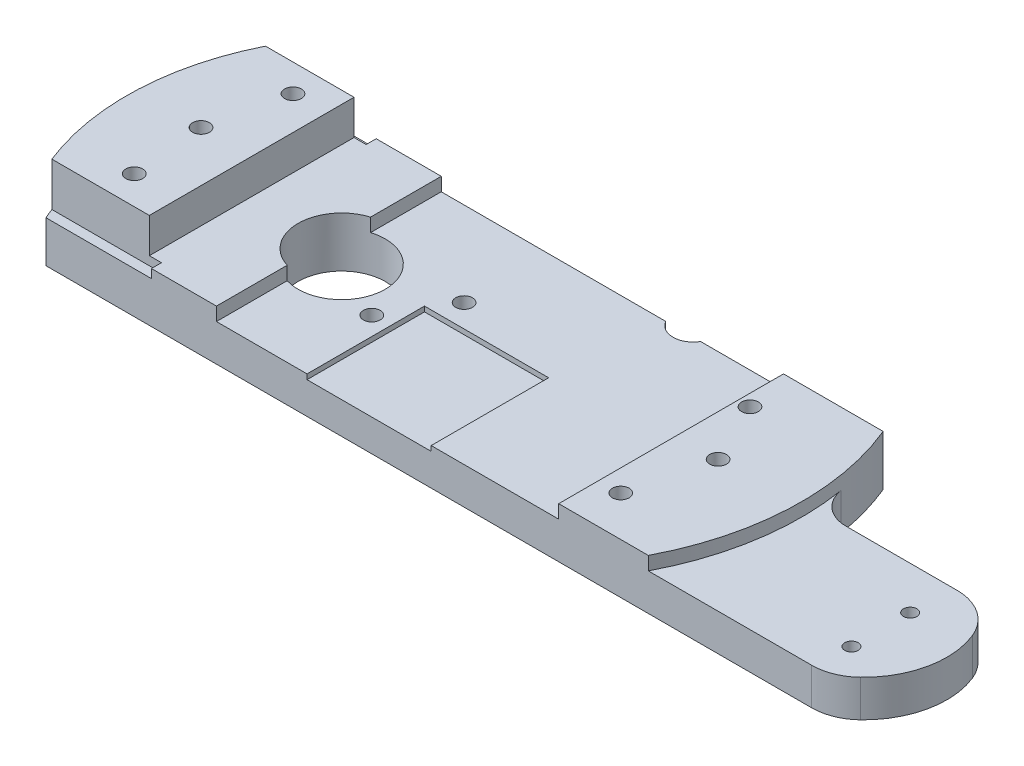
from build123d import *

# Parameters (mm, degrees)
SKETCH1_W           = 195
SKETCH1_H           = 67
BOSS_EXTRUDE1_DEPTH = 25.4
CUT_EXTRUDE1_DEPTH  = 107.177492907
CUT_EXTRUDE2_DEPTH  = 121.997561959
CUT_EXTRUDE3_START  = -13
SKETCH4_W           = 3.612655346
SKETCH4_H           = 3
CUT_EXTRUDE3_DEPTH  = 13
SKETCH6_R           = 2.5
CUT_EXTRUDE4_DEPTH  = 107.177492907
SKETCH7_W           = 37
SKETCH7_H           = 35
CUT_EXTRUDE5_DEPTH  = 1.5
CUT_EXTRUDE6_DEPTH  = 18.5
SKETCH9_R           = 2
BOSS_EXTRUDE2_DEPTH = 11
FILLET1_R           = 10
CUT_EXTRUDE7_REACH  = 163.396
SKETCH10_R          = 13


with BuildPart() as part:
    # Sketch1 → Boss-Extrude1 (new body)
    with BuildSketch(Plane(origin=(0, 0, 0), x_dir=(1, 0, 0), z_dir=(0, 1, 0))):
        Rectangle(SKETCH1_W, SKETCH1_H)
    extrude(amount=BOSS_EXTRUDE1_DEPTH)

    # Sketch2 → Cut-Extrude1 (cut, through all)
    with BuildSketch(Plane.XZ):
        with BuildLine():
            Line((97.5, -3.219751644), (97.5, 33.5))
            Line((97.5, 33.5), (88.5, 33.5))
            ThreePointArc((88.5, 33.5), (95.217186872, 15.683556008), (97.5, -3.219751644))
        make_face()
        with BuildLine():
            Line((97.5, -33.5), (97.5, -3.219751644))
            ThreePointArc((97.5, -3.219751644), (95.985558513, -18.65423771), (91.5, -33.5))
            Line((91.5, -33.5), (97.5, -33.5))
        make_face()
        with BuildLine():
            ThreePointArc((-88, -33.5), (-95.08607052, -15.861694529), (-97.5, 2.992884749))
            Line((-97.5, 2.992884749), (-97.5, -33.5))
            Line((-97.5, -33.5), (-88, -33.5))
        make_face()
        with BuildLine():
            ThreePointArc((-97.5, 2.992884749), (-95.856964648, 18.588830376), (-91, 33.5))
            Line((-91, 33.5), (-97.5, 33.5))
            Line((-97.5, 33.5), (-97.5, 2.992884749))
        make_face()
    extrude(amount=-CUT_EXTRUDE1_DEPTH, mode=Mode.SUBTRACT)

    # Sketch3 → Cut-Extrude2 (cut, through all)
    with BuildSketch(Plane(origin=(0, 0, 33.5), x_dir=(-1, 0, 0), z_dir=(0, 0, -1))):
        Polygon((63.2, 25.4), (63.2, 15), (40.2, 15), (40.2, 11), (-61.8, 11), (-61.8, 15), (-97.5, 15), (-97.5, 25.4), align=None)
    extrude(amount=CUT_EXTRUDE2_DEPTH, mode=Mode.SUBTRACT)

    # Sketch4 → Cut-Extrude3 (cut)
    with BuildSketch(Plane(origin=(0, 25.4, 0), x_dir=(1, 0, 0), z_dir=(0, 1, 0)).offset(CUT_EXTRUDE3_START)):
        with BuildLine():
            Line((-63.2, 30.5), (-63.2, 33.5))
            Line((-63.2, 33.5), (-88, 33.5))
            ThreePointArc((-88, 33.5), (-88.810680862, 32.008999469), (-89.587344654, 30.5))
            Line((-89.587344654, 30.5), (-63.2, 30.5))
        make_face()
        with Locations((-61.393672327, 32)):
            Rectangle(SKETCH4_W, SKETCH4_H)
        with BuildLine():
            Line((-63.2, -33.5), (-63.2, -30.5))
            Line((-63.2, -30.5), (-92.261692194, -30.5))
            ThreePointArc((-92.261692194, -30.5), (-91.647155152, -32.006859002), (-91, -33.5))
            Line((-91, -33.5), (-63.2, -33.5))
        make_face()
        with Locations((-61.393672327, -32)):
            Rectangle(SKETCH4_W, SKETCH4_H)
    extrude(amount=CUT_EXTRUDE3_DEPTH, mode=Mode.SUBTRACT)

    # Sketch6 → Cut-Extrude4 (cut, through all)
    with BuildSketch(Plane.XZ):
        with Locations(Location((-18.7, 8.7, 0), (0, 0, 270))):
            Circle(SKETCH6_R)
        with Locations(Location((74.1, -1.7, 0), (0, 0, 270))):
            Circle(SKETCH6_R)
        with Locations(Location((68.3, 21.5, 0), (0, 0, 270))):
            Circle(SKETCH6_R)
        with Locations(Location((65.3, -20, 0), (0, 0, 270))):
            Circle(SKETCH6_R)
        with Locations(Location((-8.2, -8.3, 0), (0, 0, 270))):
            Circle(SKETCH6_R)
        with Locations(Location((-76.2, 22, 0), (0, 0, 270))):
            Circle(SKETCH6_R)
        with Locations(Location((-78.2, 0.1, 0), (0, 0, 270))):
            Circle(SKETCH6_R)
        with Locations(Location((-73.2, -22.3, 0), (0, 0, 270))):
            Circle(SKETCH6_R)
    extrude(amount=-CUT_EXTRUDE4_DEPTH, mode=Mode.SUBTRACT)

    # Sketch7 → Cut-Extrude5 (cut)
    with BuildSketch(Plane(origin=(0, 11, 0), x_dir=(1, 0, 0), z_dir=(0, 1, 0))):
        with Locations((5.3, -16)):
            Rectangle(SKETCH7_W, SKETCH7_H)
    extrude(amount=-CUT_EXTRUDE5_DEPTH, mode=Mode.SUBTRACT)

    # Sketch8 → Cut-Extrude6 (cut)
    with BuildSketch(Plane(origin=(0, 25.4, 0), x_dir=(1, 0, 0), z_dir=(0, 1, 0))):
        with BuildLine():
            Line((37.096152423, 33.5), (31.9, 33.5))
            Line((31.9, 33.5), (31.9, 30.5))
            ThreePointArc((31.9, 30.5), (34.9, 31.303847577), (37.096152423, 33.5))
        make_face()
        with BuildLine():
            Line((31.9, 33.5), (26.703847577, 33.5))
            ThreePointArc((26.703847577, 33.5), (28.9, 31.303847577), (31.9, 30.5))
            Line((31.9, 30.5), (31.9, 33.5))
        make_face()
    extrude(amount=-CUT_EXTRUDE6_DEPTH, mode=Mode.SUBTRACT)

    # Sketch9 → Boss-Extrude2 (add)
    with BuildSketch(Plane.XZ):
        with BuildLine():
            Line((88.5, 33.5), (137.200361796, 33.5))
            ThreePointArc((137.200361796, 33.5), (142.769729546, 32.427747228), (147.542861296, 29.364285714))
            ThreePointArc((147.542861296, 29.364285714), (154.743476693, 16.527679502), (153.473750823, 1.864285714))
            ThreePointArc((153.473750823, 1.864285714), (147.953179578, -4.940573023), (139.572717606, -7.5))
            Line((139.572717606, -7.5), (97.384558849, -7.5))
            ThreePointArc((97.384558849, -7.5), (95.698800641, 13.597328658), (88.5, 33.5))
        make_face()
        with Locations(Location((138.3, 5.25, 0), (0, 0, 270))):
            Circle(SKETCH9_R, mode=Mode.SUBTRACT)
        with Locations(Location((138.3, 22.75, 0), (0, 0, 270))):
            Circle(SKETCH9_R, mode=Mode.SUBTRACT)
    extrude(amount=-BOSS_EXTRUDE2_DEPTH)

    # Fillet1
    fillet1_edges = [part.edges().sort_by_distance(p)[0] for p in [
        (97.384558849, 5.5, -7.5),
    ]]
    fillet(fillet1_edges, radius=FILLET1_R)

    # Cut-Extrude7: up to this face of the body (flat: up to its plane)
    cut_extrude7_end = Plane(part.part.faces().sort_by_distance((-51.561702064, 15, 0))[0])
    # Sketch10 → Cut-Extrude7 (cut, up to the picked face)
    with BuildSketch(Plane.XZ.offset(3), mode=Mode.PRIVATE) as cut_extrude7_sk1:
        with Locations(Location((-36.382449965, 0, 0), (0, 0, 270))):
            Circle(SKETCH10_R)
    cut_extrude7_tool1 = split(extrude(cut_extrude7_sk1.sketch, amount=-CUT_EXTRUDE7_REACH, mode=Mode.PRIVATE), bisect_by=cut_extrude7_end, keep=Keep.BOTH, mode=Mode.PRIVATE)
    add(cut_extrude7_tool1.solids().sort_by(Axis((-36.38245, -3, 0), (0, 1, 0)))[0], mode=Mode.SUBTRACT)


solid = part.part
